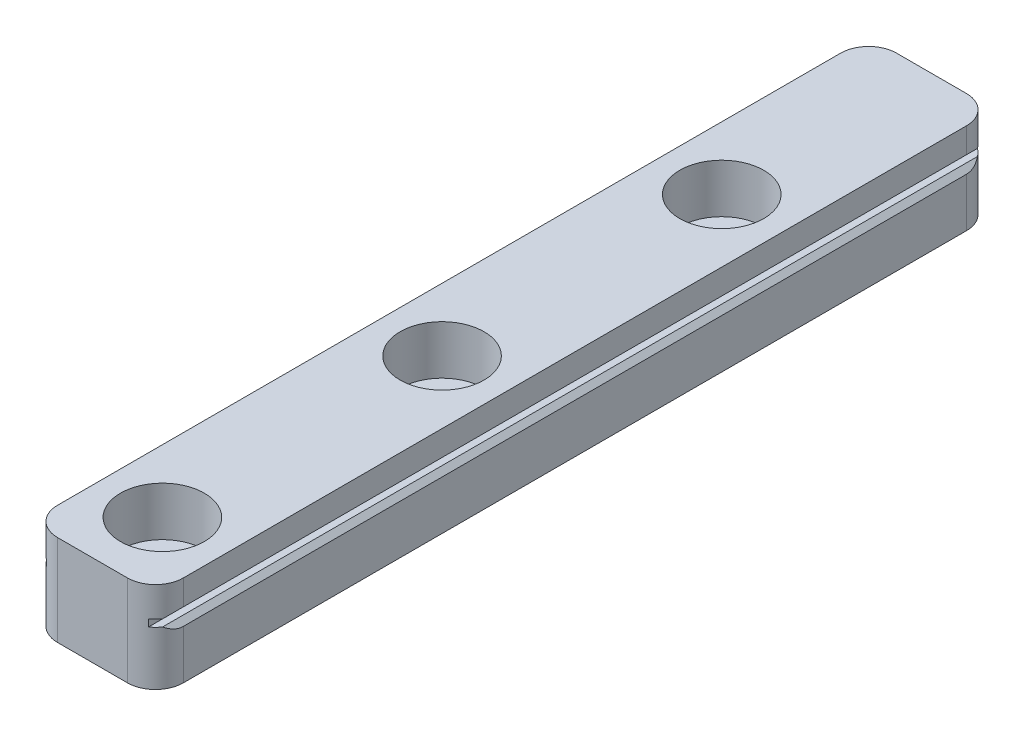
from build123d import *

# Parameters (mm, degrees)
EXTRUDE_2_DEPTH     = 60
SKETCH_3_R          = 3
CUT_EXTRUDE_1_DEPTH = 3.5
SKETCH_4_R          = 1.75
CUT_EXTRUDE_2_DEPTH = 3
FILLET_1_R          = 2


with BuildPart() as part:
    # 草图2 → 凸台-拉伸2 (new body)
    with BuildSketch(Plane.XY):
        Polygon((0, 0), (9, 0), (9, 3.5), (8.646446609, 3.853553391), (8.146446609, 3.853553391), (8.146446609, 4.353553391), (8.646446609, 4.353553391), (9, 4.707106781), (9, 6.5), (0, 6.5), (0, 4.707106781), (0.353553391, 4.353553391), (0.853553391, 4.353553391), (0.853553391, 3.853553391), (0.353553391, 3.853553391), (0, 3.5), align=None)
    extrude(amount=-EXTRUDE_2_DEPTH)

    # 草图3 → 切除-拉伸1 (cut)
    with BuildSketch(Plane(origin=(0, 6.5, 0), x_dir=(1, 0, 0), z_dir=(0, 1, 0))):
        with Locations(Location((4.5, 5, 0), (0, 0, 270))):
            Circle(SKETCH_3_R)
        with Locations(Location((4.5, 25, 0), (0, 0, 270))):
            Circle(SKETCH_3_R)
        with Locations(Location((4.5, 45, 0), (0, 0, 270))):
            Circle(SKETCH_3_R)
        with Locations((4.5, 65)):
            Circle(SKETCH_3_R)
        with Locations((4.5, 85)):
            Circle(SKETCH_3_R)
        with Locations((4.5, 105)):
            Circle(SKETCH_3_R)
        with Locations((4.5, 125)):
            Circle(SKETCH_3_R)
        with Locations((4.5, 145)):
            Circle(SKETCH_3_R)
        with Locations((4.5, 165)):
            Circle(SKETCH_3_R)
        with Locations((4.5, 185)):
            Circle(SKETCH_3_R)
        with Locations((4.5, 205)):
            Circle(SKETCH_3_R)
        with Locations((4.5, 225)):
            Circle(SKETCH_3_R)
    extrude(amount=-CUT_EXTRUDE_1_DEPTH, mode=Mode.SUBTRACT)

    # 草图4 → 切除-拉伸2 (cut)
    with BuildSketch(Plane(origin=(0, 3, 0), x_dir=(1, 0, 0), z_dir=(0, 1, 0))):
        with Locations(Location((4.5, 5, 0), (0, 0, 270))):
            Circle(SKETCH_4_R)
        with Locations(Location((4.5, 25, 0), (0, 0, 270))):
            Circle(SKETCH_4_R)
        with Locations(Location((4.5, 45, 0), (0, 0, 270))):
            Circle(SKETCH_4_R)
        with Locations((4.5, 65)):
            Circle(SKETCH_4_R)
        with Locations((4.5, 85)):
            Circle(SKETCH_4_R)
        with Locations((4.5, 105)):
            Circle(SKETCH_4_R)
        with Locations((4.5, 125)):
            Circle(SKETCH_4_R)
        with Locations((4.5, 145)):
            Circle(SKETCH_4_R)
        with Locations((4.5, 165)):
            Circle(SKETCH_4_R)
        with Locations((4.5, 185)):
            Circle(SKETCH_4_R)
        with Locations((4.5, 205)):
            Circle(SKETCH_4_R)
        with Locations((4.5, 225)):
            Circle(SKETCH_4_R)
    extrude(amount=-CUT_EXTRUDE_2_DEPTH, mode=Mode.SUBTRACT)

    # 圆角1
    fillet_1_edges = [part.edges().sort_by_distance(p)[0] for p in [
        (9, 1.75, -60),
        (0, 1.75, -60),
        (9, 1.75, 0),
        (0, 1.75, 0),
    ]]
    fillet(fillet_1_edges, radius=FILLET_1_R)


solid = part.part
